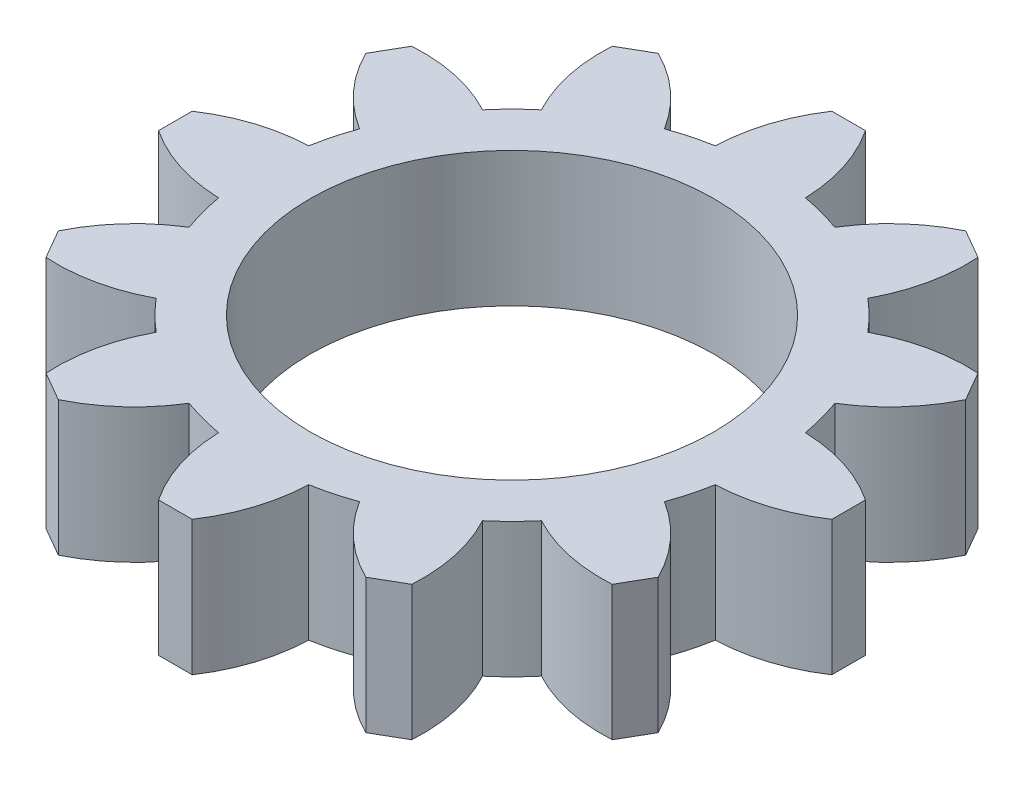
from build123d import *

# Parameters (mm, degrees)
SKETCH1_R           = 12
BOSS_EXTRUDE1_DEPTH = 4


with BuildPart() as part:
    # Sketch1 → Boss-Extrude1 (new, symmetric)
    with BuildSketch(Plane(origin=(0, 0, 0), x_dir=(1, 0, 0), z_dir=(0, 1, 0))):
        with BuildLine():
            Line((-1, 20), (1, 20))
            ThreePointArc((1, 20), (2.204975942, 17.497232023), (2.675, 14.759551992))
            ThreePointArc((2.675, 14.759551992), (3.882285677, 14.488887394), (5.063158041, 14.119646973))
            ThreePointArc((5.063158041, 14.119646973), (6.839050831, 16.255535399), (9.133974596, 17.820508076))
            Line((9.133974596, 17.820508076), (10.866025404, 16.820508076))
            ThreePointArc((10.866025404, 16.820508076), (10.658181192, 14.050559457), (9.696393951, 11.444646973))
            ThreePointArc((9.696393951, 11.444646973), (10.606601718, 10.606601718), (11.444646973, 9.696393951))
            ThreePointArc((11.444646973, 9.696393951), (14.050559457, 10.658181192), (16.820508076, 10.866025404))
            Line((16.820508076, 10.866025404), (17.820508076, 9.133974596))
            ThreePointArc((17.820508076, 9.133974596), (16.255535399, 6.839050831), (14.119646973, 5.063158041))
            ThreePointArc((14.119646973, 5.063158041), (14.488887394, 3.882285677), (14.759551992, 2.675))
            ThreePointArc((14.759551992, 2.675), (17.497232023, 2.204975942), (20, 1))
            Line((20, 1), (20, -1))
            ThreePointArc((20, -1), (17.497232023, -2.204975942), (14.759551992, -2.675))
            ThreePointArc((14.759551992, -2.675), (14.488887394, -3.882285677), (14.119646973, -5.063158041))
            ThreePointArc((14.119646973, -5.063158041), (16.255535399, -6.839050831), (17.820508076, -9.133974596))
            Line((17.820508076, -9.133974596), (16.820508076, -10.866025404))
            ThreePointArc((16.820508076, -10.866025404), (14.050559457, -10.658181192), (11.444646973, -9.696393951))
            ThreePointArc((11.444646973, -9.696393951), (10.606601718, -10.606601718), (9.696393951, -11.444646973))
            ThreePointArc((9.696393951, -11.444646973), (10.658181192, -14.050559457), (10.866025404, -16.820508076))
            Line((10.866025404, -16.820508076), (9.133974596, -17.820508076))
            ThreePointArc((9.133974596, -17.820508076), (6.839050831, -16.255535399), (5.063158041, -14.119646973))
            ThreePointArc((5.063158041, -14.119646973), (3.882285677, -14.488887394), (2.675, -14.759551992))
            ThreePointArc((2.675, -14.759551992), (2.204975942, -17.497232023), (1, -20))
            Line((1, -20), (-1, -20))
            ThreePointArc((-1, -20), (-2.204975942, -17.497232023), (-2.675, -14.759551992))
            ThreePointArc((-2.675, -14.759551992), (-3.882285677, -14.488887394), (-5.063158041, -14.119646973))
            ThreePointArc((-5.063158041, -14.119646973), (-6.839050831, -16.255535399), (-9.133974596, -17.820508076))
            Line((-9.133974596, -17.820508076), (-10.866025404, -16.820508076))
            ThreePointArc((-10.866025404, -16.820508076), (-10.658181192, -14.050559457), (-9.696393951, -11.444646973))
            ThreePointArc((-9.696393951, -11.444646973), (-10.606601718, -10.606601718), (-11.444646973, -9.696393951))
            ThreePointArc((-11.444646973, -9.696393951), (-14.050559457, -10.658181192), (-16.820508076, -10.866025404))
            Line((-16.820508076, -10.866025404), (-17.820508076, -9.133974596))
            ThreePointArc((-17.820508076, -9.133974596), (-16.255535399, -6.839050831), (-14.119646973, -5.063158041))
            ThreePointArc((-14.119646973, -5.063158041), (-14.488887394, -3.882285677), (-14.759551992, -2.675))
            ThreePointArc((-14.759551992, -2.675), (-17.497232023, -2.204975942), (-20, -1))
            Line((-20, -1), (-20, 1))
            ThreePointArc((-20, 1), (-17.497232023, 2.204975942), (-14.759551992, 2.675))
            ThreePointArc((-14.759551992, 2.675), (-14.488887394, 3.882285677), (-14.119646973, 5.063158041))
            ThreePointArc((-14.119646973, 5.063158041), (-16.255535399, 6.839050831), (-17.820508076, 9.133974596))
            Line((-17.820508076, 9.133974596), (-16.820508076, 10.866025404))
            ThreePointArc((-16.820508076, 10.866025404), (-14.050559457, 10.658181192), (-11.444646973, 9.696393951))
            ThreePointArc((-11.444646973, 9.696393951), (-10.606601718, 10.606601718), (-9.696393951, 11.444646973))
            ThreePointArc((-9.696393951, 11.444646973), (-10.658181192, 14.050559457), (-10.866025404, 16.820508076))
            Line((-10.866025404, 16.820508076), (-9.133974596, 17.820508076))
            ThreePointArc((-9.133974596, 17.820508076), (-6.839050831, 16.255535399), (-5.063158041, 14.119646973))
            ThreePointArc((-5.063158041, 14.119646973), (-3.882285677, 14.488887394), (-2.675, 14.759551992))
            ThreePointArc((-2.675, 14.759551992), (-2.204975942, 17.497232023), (-1, 20))
        make_face()
        with Locations(Location((0, 0, 0), (0, 0, 270))):
            Circle(SKETCH1_R, mode=Mode.SUBTRACT)
    extrude(amount=BOSS_EXTRUDE1_DEPTH, both=True)


solid = part.part
